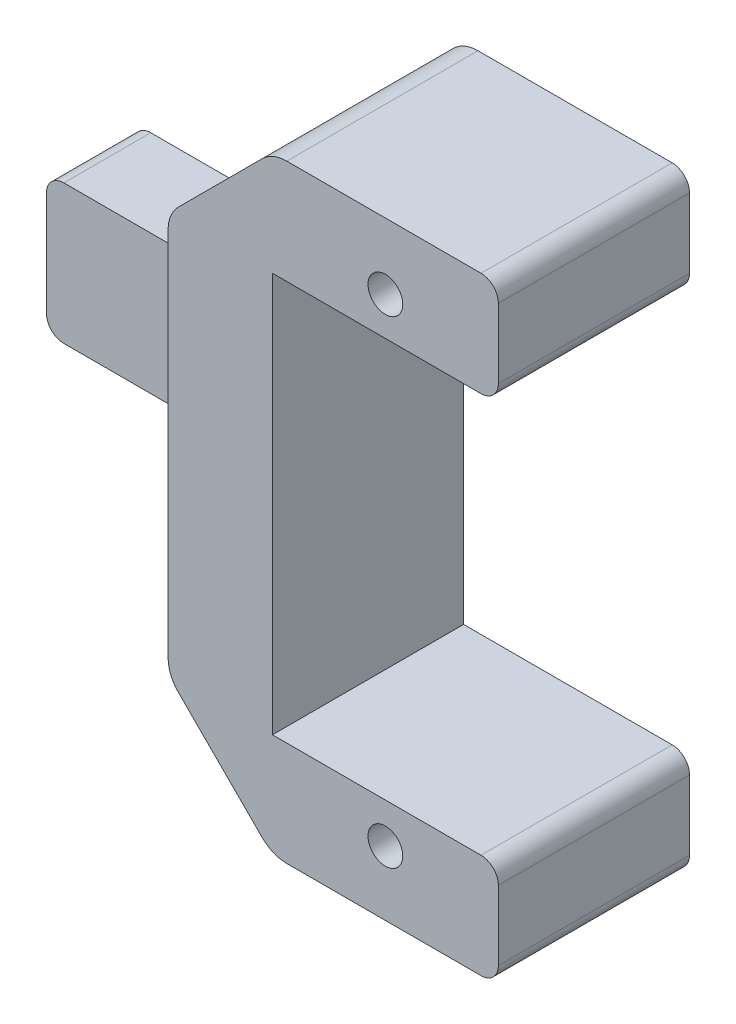
from build123d import *

# Parameters (mm, degrees)
BOSS_EXTRUDE1_DEPTH = 11
SKETCH6_R           = 1
CUT_EXTRUDE7_DEPTH  = 11
SKETCH7_R           = 1
CUT_EXTRUDE8_DEPTH  = 11
SKETCH8_R           = 1
CUT_EXTRUDE9_DEPTH  = 10
CUT_EXTRUDE_START   = -6
CUT_EXTRUDE_1_DEPTH = 6
FILLET_1_R          = 2


with BuildPart() as part:
    # Sketch1 → Boss-Extrude1 (new body)
    with BuildSketch(Plane.XY):
        with BuildLine():
            Line((-54.397881045, 39.097965902), (-66.397881045, 39.097965902))
            Line((-66.397881045, 39.097965902), (-72.397881045, 33.097965902))
            Line((-72.397881045, 33.097965902), (-72.397881045, 25.597965902))
            Line((-72.397881045, 25.597965902), (-84.397881045, 25.597965902))
            ThreePointArc((-84.397881045, 25.597965902), (-85.104987826, 25.305072683), (-85.397881045, 24.597965902))
            Line((-85.397881045, 24.597965902), (-85.397881045, 18.597965902))
            ThreePointArc((-85.397881045, 18.597965902), (-85.104987826, 17.890859121), (-84.397881045, 17.597965902))
            Line((-84.397881045, 17.597965902), (-72.397881045, 17.597965902))
            Line((-72.397881045, 17.597965902), (-72.397881045, 10.097965902))
            Line((-72.397881045, 10.097965902), (-66.397881045, 4.097965902))
            Line((-66.397881045, 4.097965902), (-54.397881045, 4.097965902))
            ThreePointArc((-54.397881045, 4.097965902), (-53.690774263, 4.390859121), (-53.397881045, 5.097965902))
            Line((-53.397881045, 5.097965902), (-53.397881045, 9.097965902))
            ThreePointArc((-53.397881045, 9.097965902), (-53.690774263, 9.805072683), (-54.397881045, 10.097965902))
            Line((-54.397881045, 10.097965902), (-66.397881045, 10.097965902))
            Line((-66.397881045, 10.097965902), (-66.397881045, 33.097965902))
            Line((-66.397881045, 33.097965902), (-54.397881045, 33.097965902))
            ThreePointArc((-54.397881045, 33.097965902), (-53.690774263, 33.390859121), (-53.397881045, 34.097965902))
            Line((-53.397881045, 34.097965902), (-53.397881045, 38.097965902))
            ThreePointArc((-53.397881045, 38.097965902), (-53.690774263, 38.805072683), (-54.397881045, 39.097965902))
        make_face()
    extrude(amount=BOSS_EXTRUDE1_DEPTH)

    # Sketch6 → Cut-Extrude7 (cut)
    with BuildSketch(Plane(origin=(0, -0.303980624, 11), x_dir=(1, 0, 0), z_dir=(0, 0, 1))):
        with Locations((-59.897881045, 35.597965902)):
            Circle(SKETCH6_R)
    extrude(amount=-CUT_EXTRUDE7_DEPTH, mode=Mode.SUBTRACT)

    # Sketch7 → Cut-Extrude8 (cut)
    with BuildSketch(Plane(origin=(0, 0.204760049, 11), x_dir=(1, 0, 0), z_dir=(0, 0, 1))):
        with Locations((-59.897881045, 7.597965902)):
            Circle(SKETCH7_R)
    extrude(amount=-CUT_EXTRUDE8_DEPTH, mode=Mode.SUBTRACT)

    # Sketch8 → Cut-Extrude9 (cut)
    with BuildSketch(Plane(origin=(0, 25.597965902, 0), x_dir=(1, 0, 0), z_dir=(0, 1, 0))):
        with Locations(Location((-78.897881045, -2, 0), (0, 0, 270))):
            Circle(SKETCH8_R)
    extrude(amount=-CUT_EXTRUDE9_DEPTH, mode=Mode.SUBTRACT)

    # Эскиз1 → Вырез-Вытянуть1 (cut)
    with BuildSketch(Plane.XY.offset(11).offset(CUT_EXTRUDE_START)):
        with BuildLine():
            Line((-72.397881045, 17.597965902), (-72.397881045, 25.597965902))
            Line((-72.397881045, 25.597965902), (-84.397881045, 25.597965902))
            ThreePointArc((-84.397881045, 25.597965902), (-85.104987826, 25.305072683), (-85.397881045, 24.597965902))
            Line((-85.397881045, 24.597965902), (-85.397881045, 18.597965902))
            ThreePointArc((-85.397881045, 18.597965902), (-85.104987826, 17.890859121), (-84.397881045, 17.597965902))
            Line((-84.397881045, 17.597965902), (-72.397881045, 17.597965902))
        make_face()
    extrude(amount=CUT_EXTRUDE_1_DEPTH, mode=Mode.SUBTRACT)

    # Скругление1
    fillet_1_edges = [part.edges().sort_by_distance(p)[0] for p in [
        (-72.397881045, 10.097965902, 5.5),
        (-72.397881045, 33.097965902, 5.5),
        (-66.397881045, 39.097965902, 5.5),
        (-66.397881045, 4.097965902, 5.5),
    ]]
    fillet(fillet_1_edges, radius=FILLET_1_R)


solid = part.part
